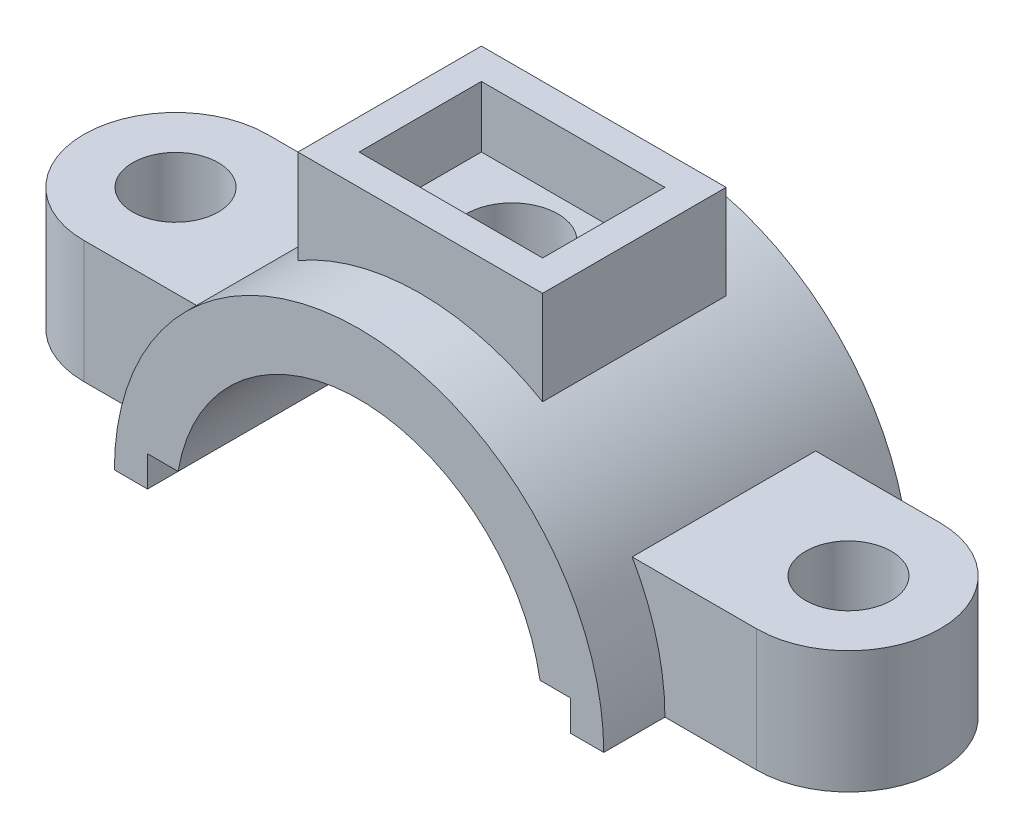
from build123d import *

# Parameters (mm, degrees)
BOSS_EXTRUDE3_DEPTH      = 25
SKETCH5_R                = 7
BOSS_EXTRUDE4_DEPTH      = 20
BOSS_EXTRUDE6_REACH      = 91.582
BOSS_EXTRUDE6_END_RADIUS = 40
SKETCH8_W                = 40
SKETCH8_H                = 30
SKETCH9_W                = 30
SKETCH9_H                = 20
CUT_EXTRUDE3_DEPTH       = 10
SKETCH10_R               = 7.5
CUT_EXTRUDE4_DEPTH       = 90.582364336


with BuildPart() as part:
    # Sketch4 → Boss-Extrude3 (new, symmetric)
    with BuildSketch(Plane.XY):
        with BuildLine():
            Line((-34.580398915, 5), (-29.580398915, 5))
            ThreePointArc((-29.580398915, 5), (0, 30), (29.580398915, 5))
            Line((29.580398915, 5), (34.580398915, 5))
            Line((34.580398915, 5), (34.580398915, 0))
            Line((34.580398915, 0), (40, 0))
            ThreePointArc((40, 0), (0, 40), (-40, 0))
            Line((-40, 0), (-34.580398915, 0))
            Line((-34.580398915, 0), (-34.580398915, 5))
        make_face()
    extrude(amount=BOSS_EXTRUDE3_DEPTH, both=True)

    # Sketch5 → Boss-Extrude4 (add)
    # profile 1 of 2: a face of its own
    with BuildSketch(Plane(origin=(0, 0, 0), x_dir=(1, 0, 0), z_dir=(0, 1, 0))):
        with BuildLine():
            Line((-55, 15), (-34.580398915, 15))
            Line((-34.580398915, 15), (-34.580398915, -15))
            Line((-34.580398915, -15), (-55, -15))
            ThreePointArc((-55, -15), (-70, 0), (-55, 15))
        make_face()
        with Locations(Location((-55, 0, 0), (0, 0, 270))):
            Circle(SKETCH5_R, mode=Mode.SUBTRACT)
    # profile 2 of 2: a face of its own
    with BuildSketch(Plane(origin=(0, 0, 0), x_dir=(1, 0, 0), z_dir=(0, 1, 0))):
        with BuildLine():
            Line((34.580398915, 15), (55, 15))
            ThreePointArc((55, 15), (70, 0), (55, -15))
            Line((55, -15), (34.580398915, -15))
            Line((34.580398915, -15), (34.580398915, 15))
        make_face()
        with Locations(Location((55, 0, 0), (0, 0, 270))):
            Circle(SKETCH5_R, mode=Mode.SUBTRACT)
    extrude(amount=BOSS_EXTRUDE4_DEPTH)

    # Boss-Extrude6: up to this cylinder (the profile starts outside it)
    boss_extrude6_end = Plane(origin=(0, 0, 0), z_dir=(0, 0, -1)) * Cylinder(BOSS_EXTRUDE6_END_RADIUS, 264.164, mode=Mode.PRIVATE)
    # Sketch8 → Boss-Extrude6 (add, up to the surface)
    with BuildSketch(Plane(origin=(0, 50, 0), x_dir=(1, 0, 0), z_dir=(0, 1, 0)), mode=Mode.PRIVATE) as boss_extrude6_sk1:
        Rectangle(SKETCH8_W, SKETCH8_H)
    boss_extrude6_tool1 = extrude(boss_extrude6_sk1.sketch, amount=-BOSS_EXTRUDE6_REACH, mode=Mode.PRIVATE) - boss_extrude6_end
    add(boss_extrude6_tool1.solids().sort_by_distance((0, 50, 0))[0])

    # Sketch9 → Cut-Extrude3 (cut)
    with BuildSketch(Plane(origin=(0, 50, 0), x_dir=(1, 0, 0), z_dir=(0, 1, 0))):
        Rectangle(SKETCH9_W, SKETCH9_H)
    extrude(amount=-CUT_EXTRUDE3_DEPTH, mode=Mode.SUBTRACT)

    # Sketch10 → Cut-Extrude4 (cut, through all)
    with BuildSketch(Plane(origin=(0, 50, 0), x_dir=(1, 0, 0), z_dir=(0, 1, 0))):
        with Locations(Location((0, 0, 0), (0, 0, 270))):
            Circle(SKETCH10_R)
    extrude(amount=-CUT_EXTRUDE4_DEPTH, mode=Mode.SUBTRACT)


solid = part.part
